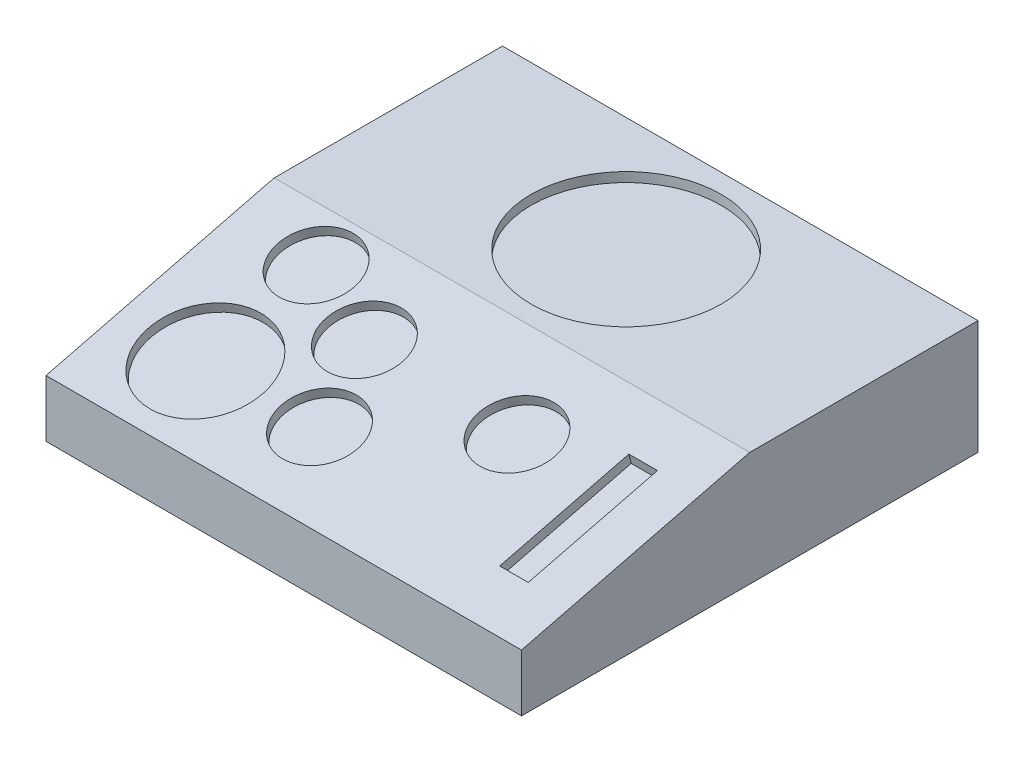
from build123d import *

# Parameters (mm, degrees)
CROQUIS1_W              = 250
CROQUIS1_H              = 120
SALIENTE_EXTRUIR1_DEPTH = 60
SALIENTE_EXTRUIR2_DEPTH = 250
CROQUIS3_R              = 50
CORTAR_EXTRUIR1_DEPTH   = 5
CROQUIS5_R              = 30
CROQUIS5_R_2            = 20
CROQUIS5_W              = 15
CROQUIS5_H              = 70
CORTAR_EXTRUIR2_DEPTH   = 5


with BuildPart() as part:
    # Croquis1 → Saliente-Extruir1 (new body)
    with BuildSketch(Plane(origin=(0, 0, 0), x_dir=(1, 0, 0), z_dir=(0, 1, 0))):
        Rectangle(CROQUIS1_W, CROQUIS1_H)
    extrude(amount=SALIENTE_EXTRUIR1_DEPTH)

    # Croquis2 → Saliente-Extruir2 (add)
    with BuildSketch(Plane.ZY.offset(125)):
        Polygon((60, 60), (60, 0), (180, 0), (180, 30), align=None)
    extrude(amount=-SALIENTE_EXTRUIR2_DEPTH)

    # Croquis3 → Cortar-Extruir1 (cut)
    with BuildSketch(Plane(origin=(0, 60, 0), x_dir=(1, 0, 0), z_dir=(0, 1, 0))):
        with Locations(Location((0, 0, 0), (0, 0, 270))):
            Circle(CROQUIS3_R)
    extrude(amount=-CORTAR_EXTRUIR1_DEPTH, mode=Mode.SUBTRACT)

    # Croquis5 → Cortar-Extruir2 (cut)
    with BuildSketch(Plane(origin=(0, 70.588235294, 17.647058824), x_dir=(-1, 0, 0), z_dir=(0, 0.970142500145332, 0.24253562503633302))):
        with Locations(Location((80, 127.349581275, 0), (0, 0, 90))):
            Circle(CROQUIS5_R)
        with Locations(Location((80, 67.349581275, 0), (0, 0, 90))):
            Circle(CROQUIS5_R_2)
        with Locations(Location((37.573593129, 84.923174404, 0), (0, 0, 90))):
            Circle(CROQUIS5_R_2)
        with Locations(Location((20, 127.349581275, 0), (0, 0, 90))):
            Circle(CROQUIS5_R_2)
        with Locations(Location((-45, 87.349581275, 0), (0, 0, 90))):
            Circle(CROQUIS5_R_2)
        with Locations((-95, 105.502996891)):
            Rectangle(CROQUIS5_W, CROQUIS5_H)
    extrude(amount=-CORTAR_EXTRUIR2_DEPTH, mode=Mode.SUBTRACT)


solid = part.part
